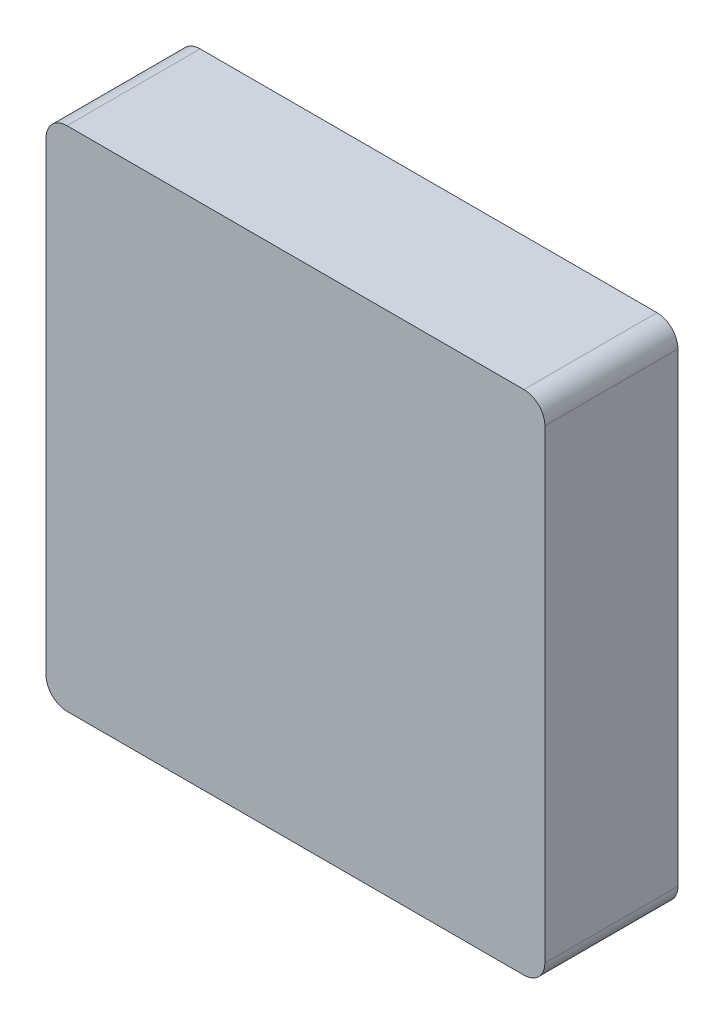
from build123d import *

# Parameters (mm, degrees)
SKETCH1_W           = 11.9
SKETCH1_H           = 12.1
BOSS_EXTRUDE1_DEPTH = 3.175
FILLET1_R           = 0.5


with BuildPart() as part:
    # Sketch1 → Boss-Extrude1 (new body)
    with BuildSketch(Plane.XY):
        Rectangle(SKETCH1_W, SKETCH1_H)
    extrude(amount=BOSS_EXTRUDE1_DEPTH)

    # Fillet1
    fillet1_edges = [part.edges().sort_by_distance(p)[0] for p in [
        (-5.95, 6.05, 1.5875),
        (5.95, 6.05, 1.5875),
        (5.95, -6.05, 1.5875),
        (-5.95, -6.05, 1.5875),
    ]]
    fillet(fillet1_edges, radius=FILLET1_R)


solid = part.part
